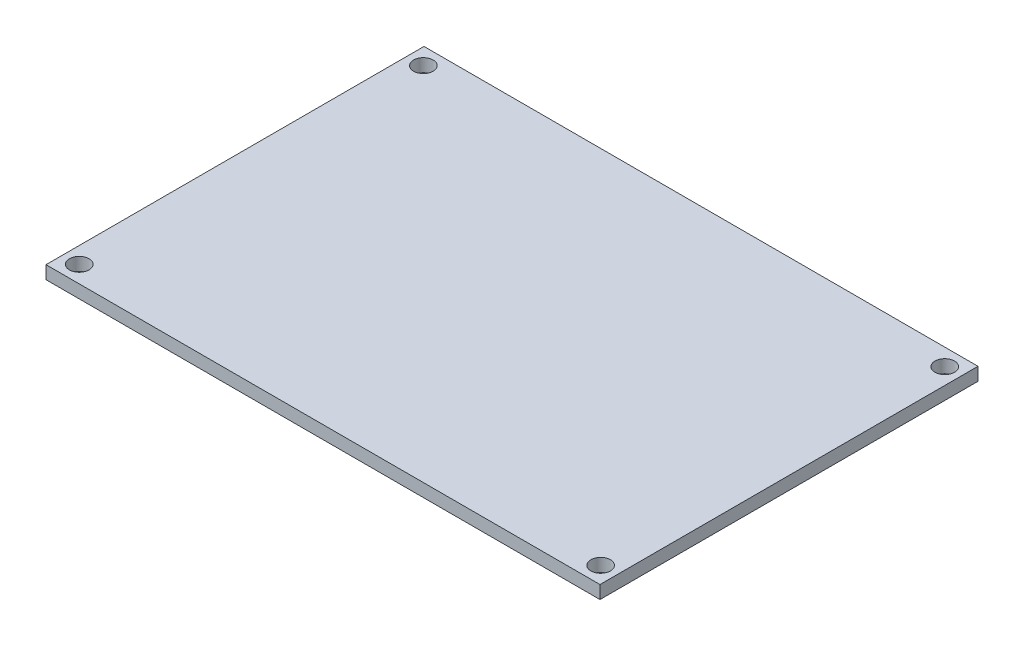
from build123d import *

# Parameters (mm, degrees)
SKETCH_1_W          = 85
SKETCH_1_H          = 58
EXTRUDE_1_DEPTH     = 2
SKETCH_2_R          = 1.5
CUT_EXTRUDE_1_DEPTH = 2


with BuildPart() as part:
    # 草图1 → 凸台-拉伸1 (new body)
    with BuildSketch(Plane(origin=(0, 0, 0), x_dir=(1, 0, 0), z_dir=(0, 1, 0))):
        Rectangle(SKETCH_1_W, SKETCH_1_H)
    extrude(amount=EXTRUDE_1_DEPTH)

    # 草图2 → 切除-拉伸1 (cut)
    with BuildSketch(Plane(origin=(0, 2, 0), x_dir=(1, 0, 0), z_dir=(0, 1, 0))):
        with Locations(Location((-40, 26.4, 0), (0, 0, 270))):
            Circle(SKETCH_2_R)
        with Locations(Location((40, 26.4, 0), (0, 0, 270))):
            Circle(SKETCH_2_R)
        with Locations(Location((40, -26.4, 0), (0, 0, 270))):
            Circle(SKETCH_2_R)
        with Locations(Location((-40, -26.4, 0), (0, 0, 270))):
            Circle(SKETCH_2_R)
    extrude(amount=-CUT_EXTRUDE_1_DEPTH, mode=Mode.SUBTRACT)


solid = part.part
